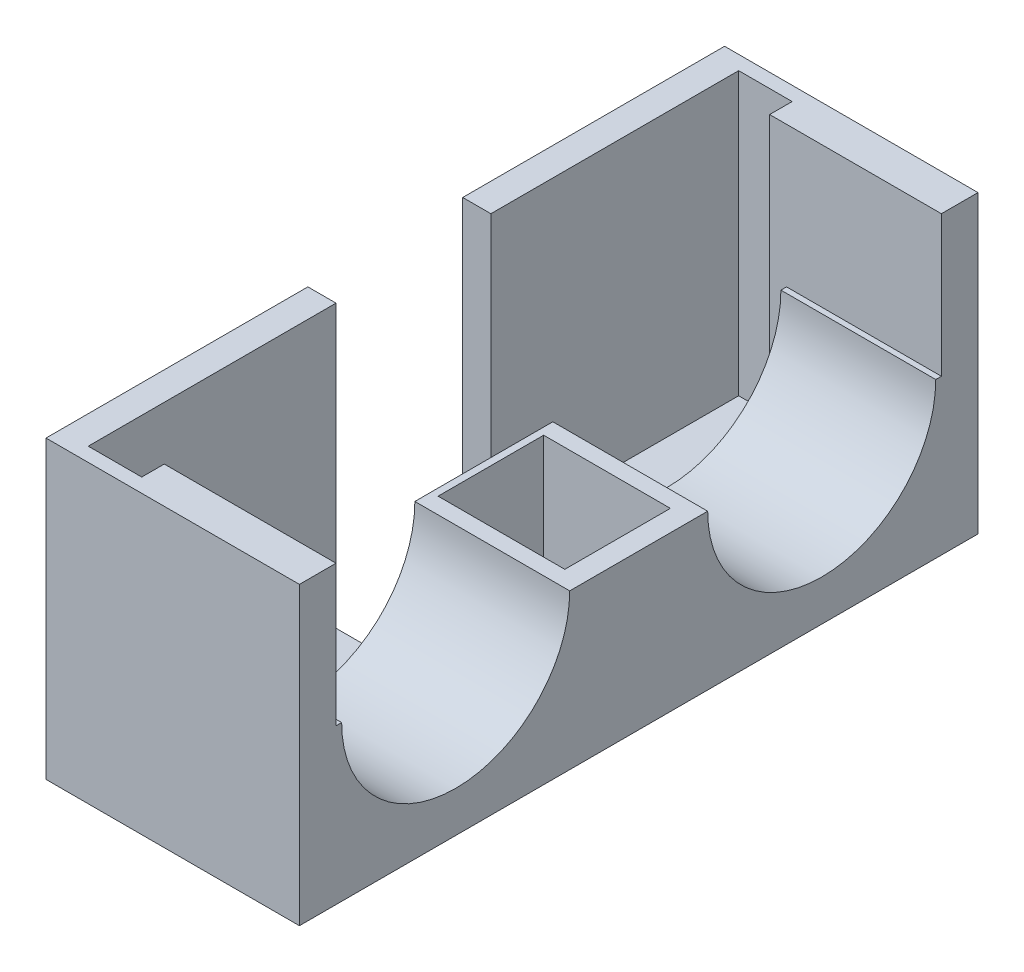
from build123d import *

# Parameters (mm, degrees)
SKETCH1_W               = 25
SKETCH1_H               = 48.2
BOSS_EXTRUDE1_DEPTH     = 1
SKETCH2_W               = 11
SKETCH2_H               = 43
BOSS_EXTRUDE2_DEPTH     = 10
SKETCH3_R               = 8.1
CUT_EXTRUDE1_DEPTH      = 11
BOSS_EXTRUDE3_DEPTH     = 20
BOSS_EXTRUDE4_DEPTH     = 2
SKETCH7_W               = 48.2
SKETCH7_H               = 21
BOSS_EXTRUDE5_DEPTH     = 2
CUT_EXTRUDE2_DEPTH      = 20
CUT_EXTRUDE2_DEPTH_BACK = 1
SKETCH8_W               = 4
SKETCH8_H               = 11
SKETCH9_W               = 9
SKETCH9_H               = 7.5
CUT_EXTRUDE3_DEPTH      = 10
SKETCH10_R              = 0.75
SKETCH10_R_2            = 0.5
CUT_EXTRUDE4_DEPTH      = 1
SKETCH11_W              = 11
SKETCH11_H              = 48.2
CUT_EXTRUDE5_DEPTH      = 1


with BuildPart() as part:
    # Sketch1 → Boss-Extrude1 (new body)
    with BuildSketch(Plane(origin=(0, 0, 0), x_dir=(1, 0, 0), z_dir=(0, 1, 0))):
        Rectangle(SKETCH1_W, SKETCH1_H)
    extrude(amount=BOSS_EXTRUDE1_DEPTH)

    # Sketch2 → Boss-Extrude2 (add)
    with BuildSketch(Plane(origin=(0, 1, 0), x_dir=(1, 0, 0), z_dir=(0, 1, 0))):
        with Locations((-4, 0)):
            Rectangle(SKETCH2_W, SKETCH2_H)
    extrude(amount=BOSS_EXTRUDE2_DEPTH)

    # Sketch3 → Cut-Extrude1 (cut)
    with BuildSketch(Plane(origin=(1.5, 0, 0), x_dir=(0, 0, -1), z_dir=(1, 0, 0))):
        with Locations((-13, 11)):
            Circle(SKETCH3_R)
        with Locations((13, 11)):
            Circle(SKETCH3_R)
    extrude(amount=-CUT_EXTRUDE1_DEPTH, mode=Mode.SUBTRACT)

    # Sketch4 → Boss-Extrude3 (add)
    with BuildSketch(Plane(origin=(0, 1, 0), x_dir=(1, 0, 0), z_dir=(0, 1, 0))):
        Polygon((-9.5, -21.5), (-10.7, -21.5), (-10.7, -23.1), (-12.5, -23.1), (-12.5, -24.1), (1.5, -24.1), (1.5, -21.5), align=None)
    boss_extrude3 = extrude(amount=BOSS_EXTRUDE3_DEPTH)

    # Mirror2: Boss-Extrude3 across plane
    add(boss_extrude3.mirror(Plane.XY))

    # Sketch5 → Boss-Extrude4 (add)
    with BuildSketch(Plane.ZY.offset(12.5)):
        Polygon((-24.1, 21), (-23.1, 21), (-23.1, 1), (23.1, 1), (23.1, 21), (24.1, 21), (24.1, 0), (-24.1, 0), align=None)
    extrude(amount=BOSS_EXTRUDE4_DEPTH)

    # Sketch7 → Boss-Extrude5 (add)
    with BuildSketch(Plane.ZY.offset(14.5)):
        with Locations((0, 10.5)):
            Rectangle(SKETCH7_W, SKETCH7_H)
    extrude(amount=BOSS_EXTRUDE5_DEPTH)

    # Sketch8 → Cut-Extrude2 (cut, two sides: drawn at the far end of the back side and taken through both)
    with BuildSketch(Plane(origin=(0, 1, 0), x_dir=(1, 0, 0), z_dir=(0, 1, 0)).offset(-CUT_EXTRUDE2_DEPTH_BACK)):
        with Locations((-14.5, 0)):
            Rectangle(SKETCH8_W, SKETCH8_H)
    extrude(amount=CUT_EXTRUDE2_DEPTH + CUT_EXTRUDE2_DEPTH_BACK, mode=Mode.SUBTRACT)

    # Sketch9 → Cut-Extrude3 (cut)
    with BuildSketch(Plane(origin=(0, 11, 0), x_dir=(1, 0, 0), z_dir=(0, 1, 0))):
        with Locations((-4.5, 0)):
            Rectangle(SKETCH9_W, SKETCH9_H)
    extrude(amount=-CUT_EXTRUDE3_DEPTH, mode=Mode.SUBTRACT)

    # Sketch10 → Cut-Extrude4 (cut)
    with BuildSketch(Plane(origin=(0, 1, 0), x_dir=(1, 0, 0), z_dir=(0, 1, 0))):
        with Locations(Location((-4.5, 0, 0), (0, 0, 270))):
            Circle(SKETCH10_R)
        with Locations(Location((-3.75, 2.5, 0), (0, 0, 270))):
            Circle(SKETCH10_R_2)
        with Locations(Location((-3.75, -2.5, 0), (0, 0, 270))):
            Circle(SKETCH10_R_2)
    extrude(amount=-CUT_EXTRUDE4_DEPTH, mode=Mode.SUBTRACT)

    # Sketch11 → Cut-Extrude5 (cut)
    with BuildSketch(Plane(origin=(0, 1, 0), x_dir=(1, 0, 0), z_dir=(0, 1, 0))):
        with Locations((7, 0)):
            Rectangle(SKETCH11_W, SKETCH11_H)
    extrude(amount=-CUT_EXTRUDE5_DEPTH, mode=Mode.SUBTRACT)


solid = part.part
